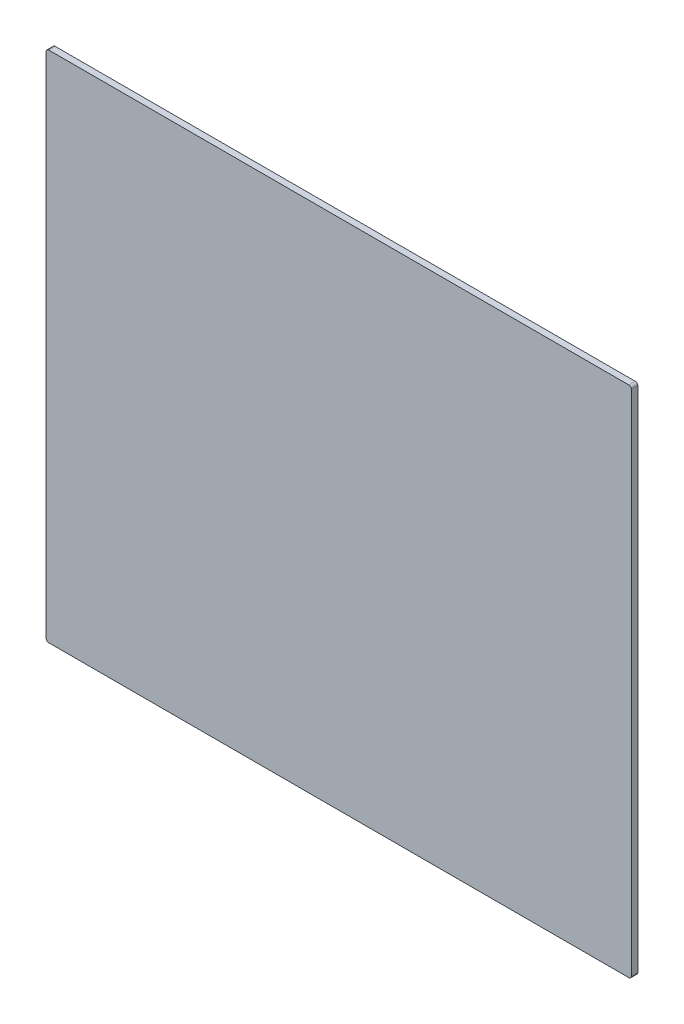
from build123d import *

# Parameters (mm, degrees)
BOSS_EXTRU_1_DEPTH = 10


with BuildPart() as part:
    # Esquisse1 → Boss.-Extru.1 (new body)
    with BuildSketch(Plane.XY):
        with BuildLine():
            Line((-452, -400), (452, -400))
            ThreePointArc((452, -400), (454.828427125, -398.828427125), (456, -396))
            Line((456, -396), (456, 396))
            ThreePointArc((456, 396), (454.828427125, 398.828427125), (452, 400))
            Line((452, 400), (-452, 400))
            ThreePointArc((-452, 400), (-454.828427125, 398.828427125), (-456, 396))
            Line((-456, 396), (-456, -396))
            ThreePointArc((-456, -396), (-454.828427125, -398.828427125), (-452, -400))
        make_face()
    extrude(amount=BOSS_EXTRU_1_DEPTH)


solid = part.part
